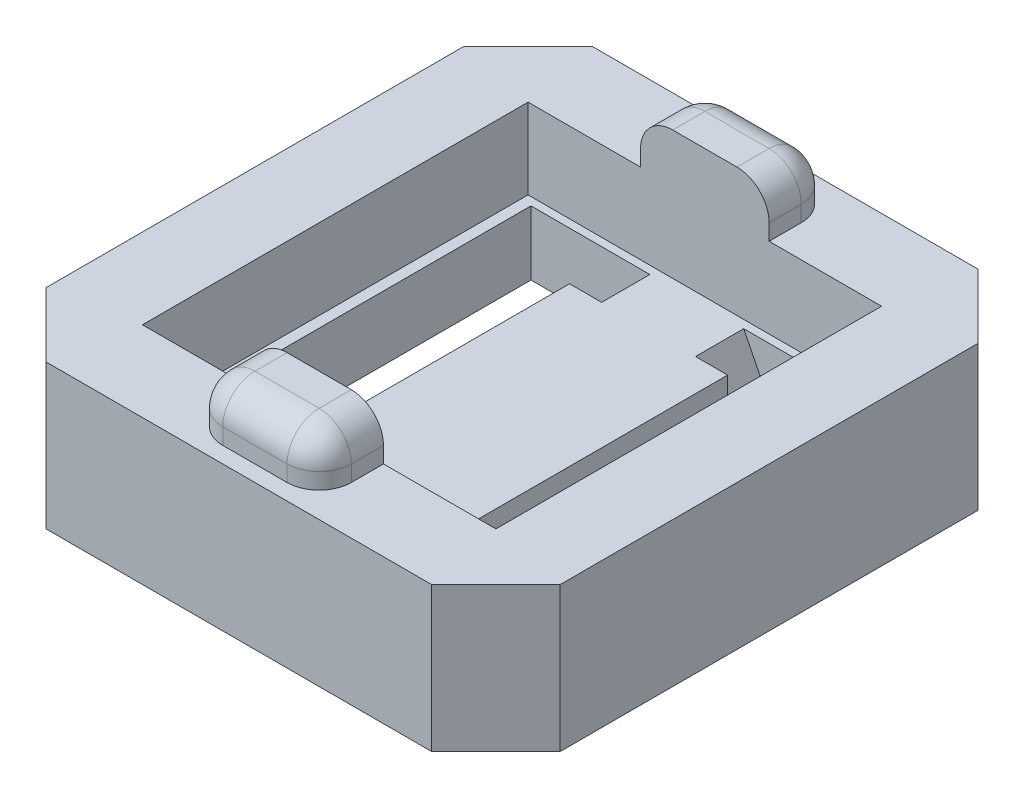
from build123d import *

# Parameters (mm, degrees)
SKETCH1_W           = 16
SKETCH1_H           = 17
SKETCH1_W_2         = 11
SKETCH1_H_2         = 12
BOSS_EXTRUDE1_DEPTH = 2.5
SKETCH2_W           = 16
SKETCH2_H           = 17
BOSS_EXTRUDE2_DEPTH = 2
SKETCH4_W           = 2.7
SKETCH4_H           = 11.5
CUT_EXTRUDE1_DEPTH  = 12.937336386
CHAMFER1_SIZE       = 2
SKETCH5_W           = 4
SKETCH5_H           = 2
BOSS_EXTRUDE3_DEPTH = 1.5
FILLET1_R           = 1
FILLET2_R           = 1
CUT_EXTRUDE2_DEPTH  = 1.5
CUT_EXTRUDE3_DEPTH  = 1.5


with BuildPart() as part:
    # Sketch1 → Boss-Extrude1 (new body)
    with BuildSketch(Plane(origin=(0, 0, 0), x_dir=(1, 0, 0), z_dir=(0, 1, 0))):
        Rectangle(SKETCH1_W, SKETCH1_H)
        Rectangle(SKETCH1_W_2, SKETCH1_H_2, mode=Mode.SUBTRACT)
    extrude(amount=BOSS_EXTRUDE1_DEPTH)

    # Sketch2 → Boss-Extrude2 (add)
    with BuildSketch(Plane.XZ):
        Rectangle(SKETCH2_W, SKETCH2_H)
    extrude(amount=BOSS_EXTRUDE2_DEPTH)

    # Sketch4 → Cut-Extrude1 (cut, through all)
    with BuildSketch(Plane(origin=(0, 0, 0), x_dir=(1, 0, 0), z_dir=(0, 1, 0))):
        with Locations((-3.81, 0)):
            Rectangle(SKETCH4_W, SKETCH4_H)
        with Locations((3.81, 0)):
            Rectangle(SKETCH4_W, SKETCH4_H)
    extrude(amount=-CUT_EXTRUDE1_DEPTH, mode=Mode.SUBTRACT)

    # Chamfer1
    chamfer1_edges = [part.edges().sort_by_distance(p)[0] for p in [
        (8, 0.25, -8.5),
        (-8, 0.25, -8.5),
        (-8, 0.25, 8.5),
        (8, 0.25, 8.5),
    ]]
    chamfer(chamfer1_edges, length=CHAMFER1_SIZE)

    # Sketch5 → Boss-Extrude3 (add)
    with BuildSketch(Plane(origin=(0, 2.5, 0), x_dir=(1, 0, 0), z_dir=(0, 1, 0))):
        with Locations((0, 7)):
            Rectangle(SKETCH5_W, SKETCH5_H)
        with Locations((0, -7)):
            Rectangle(SKETCH5_W, SKETCH5_H)
    extrude(amount=BOSS_EXTRUDE3_DEPTH)

    # Fillet1
    fillet1_edges = [part.edges().sort_by_distance(p)[0] for p in [
        (2, 4, -7),
        (-2, 4, -7),
        (2, 4, 7),
        (-2, 4, 7),
    ]]
    fillet(fillet1_edges, radius=FILLET1_R)

    # Fillet2
    fillet2_edges = [part.edges().sort_by_distance(p)[0] for p in [
        (1.707106781, 3.707106781, -8),
        (1.707106781, 3.707106781, 8),
        (-1.707106781, 3.707106781, -8),
        (-1.707106781, 3.707106781, 8),
        (0, 4, -8),
        (0, 4, 8),
        (-2, 2.75, -8),
        (2, 2.75, -8),
        (2, 2.75, 8),
        (-2, 2.75, 8),
    ]]
    fillet(fillet2_edges, radius=FILLET2_R)

    # Sketch6 → Cut-Extrude2 (cut)
    with BuildSketch(Plane.XY.offset(-5.75)):
        Polygon((-2.46, -2), (-2.46, 0), (-1.46, 0), align=None)
        Polygon((2.46, -2), (2.46, 0), (1.46, 0), align=None)
    extrude(amount=CUT_EXTRUDE2_DEPTH, mode=Mode.SUBTRACT)

    # Sketch8 → Cut-Extrude3 (cut)
    with BuildSketch(Plane(origin=(0, 0, 5.75), x_dir=(-1, 0, 0), z_dir=(0, 0, -1))):
        Polygon((-2.46, 0), (-2.46, -2), (-1.46, 0), align=None)
        Polygon((2.46, -2), (2.46, 0), (1.46, 0), align=None)
    extrude(amount=CUT_EXTRUDE3_DEPTH, mode=Mode.SUBTRACT)


solid = part.part
